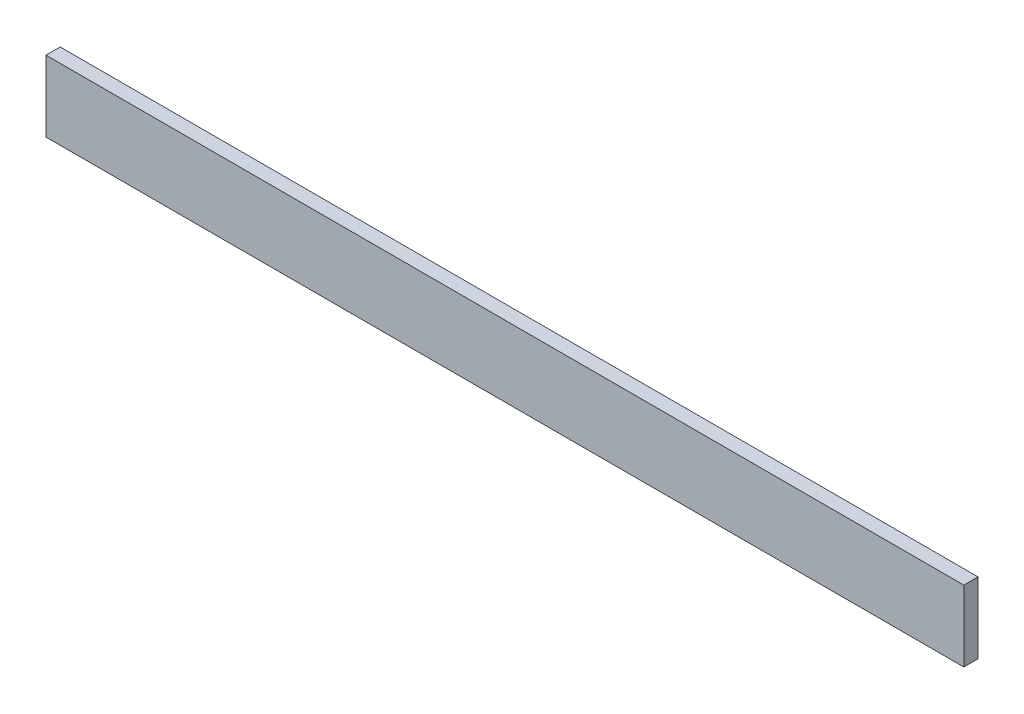
from build123d import *

# Parameters (mm, degrees)
SKETCH1_W           = 97
SKETCH1_H           = 7.5
BOSS_EXTRUDE1_DEPTH = 1.5
SCALE1_SCALE        = 10


with BuildPart() as part:
    # Sketch1 → Boss-Extrude1 (new body)
    with BuildSketch(Plane.XY):
        with Locations((48.5, 3.75)):
            Rectangle(SKETCH1_W, SKETCH1_H)
    extrude(amount=BOSS_EXTRUDE1_DEPTH)


with BuildPart() as part_1:
    # Scale1: scaled about (0, 0, 0)
    add(part.part.scale(SCALE1_SCALE))


solid = part_1.part
